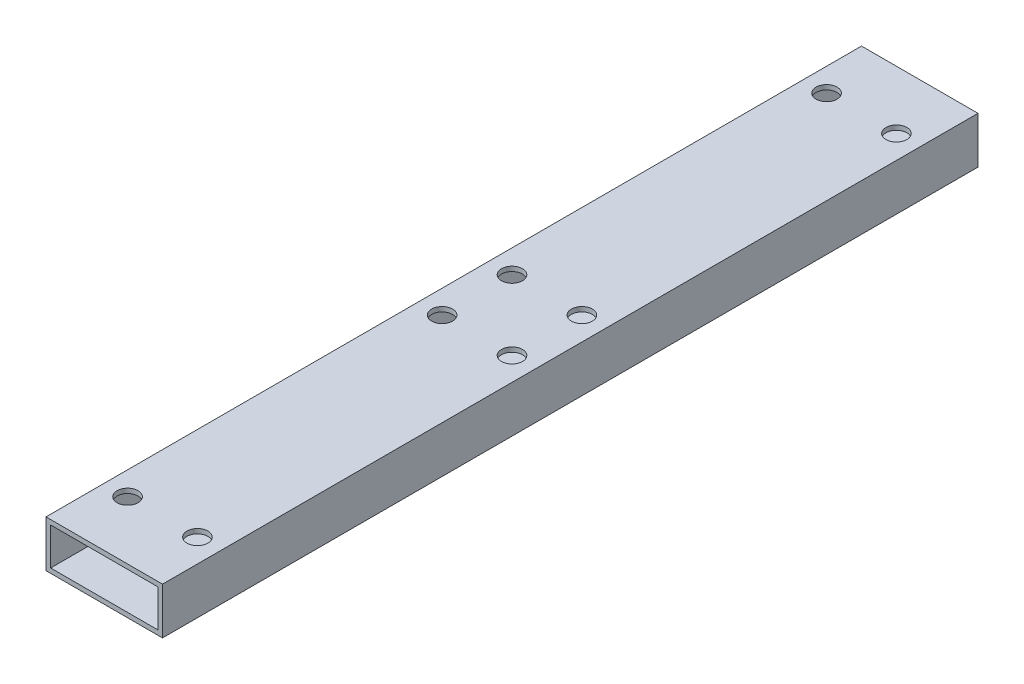
from build123d import *

# Parameters (mm, degrees)
SKETCH_1_W          = 50
SKETCH_1_H          = 20
EXTRUDE_1_DEPTH     = 350
SKETCH_2_W          = 46
SKETCH_2_H          = 16
CUT_EXTRUDE_1_DEPTH = 352.034186369
SKETCH_3_R          = 4.5
CUT_EXTRUDE_3_DEPTH = 352.461235416


with BuildPart() as part:
    # Эскиз1 → Бобышка-Вытянуть1 (new body)
    with BuildSketch(Plane.XY):
        Rectangle(SKETCH_1_W, SKETCH_1_H)
    extrude(amount=EXTRUDE_1_DEPTH)

    # Эскиз2 → Вырез-Вытянуть1 (cut, through all)
    with BuildSketch(Plane.XY.offset(350)):
        Rectangle(SKETCH_2_W, SKETCH_2_H)
    extrude(amount=-CUT_EXTRUDE_1_DEPTH, mode=Mode.SUBTRACT)

    # Эскиз3 → Вырез-Вытянуть3 (cut, through all)
    with BuildSketch(Plane(origin=(0, 10, 0), x_dir=(-1, 0, 0), z_dir=(0, 1, 0))):
        with Locations(Location((-15, 325, 0), (0, 0, 90))):
            Circle(SKETCH_3_R)
        with Locations(Location((15, 325, 0), (0, 0, 90))):
            Circle(SKETCH_3_R)
        with Locations(Location((-15, 25, 0), (0, 0, 90))):
            Circle(SKETCH_3_R)
        with Locations(Location((15, 25, 0), (0, 0, 90))):
            Circle(SKETCH_3_R)
        with Locations(Location((-15, 160, 0), (0, 0, 90))):
            Circle(SKETCH_3_R)
        with Locations(Location((-15, 190, 0), (0, 0, 90))):
            Circle(SKETCH_3_R)
        with Locations(Location((15, 190, 0), (0, 0, 90))):
            Circle(SKETCH_3_R)
        with Locations(Location((15, 160, 0), (0, 0, 90))):
            Circle(SKETCH_3_R)
    extrude(amount=-CUT_EXTRUDE_3_DEPTH, mode=Mode.SUBTRACT)


solid = part.part
